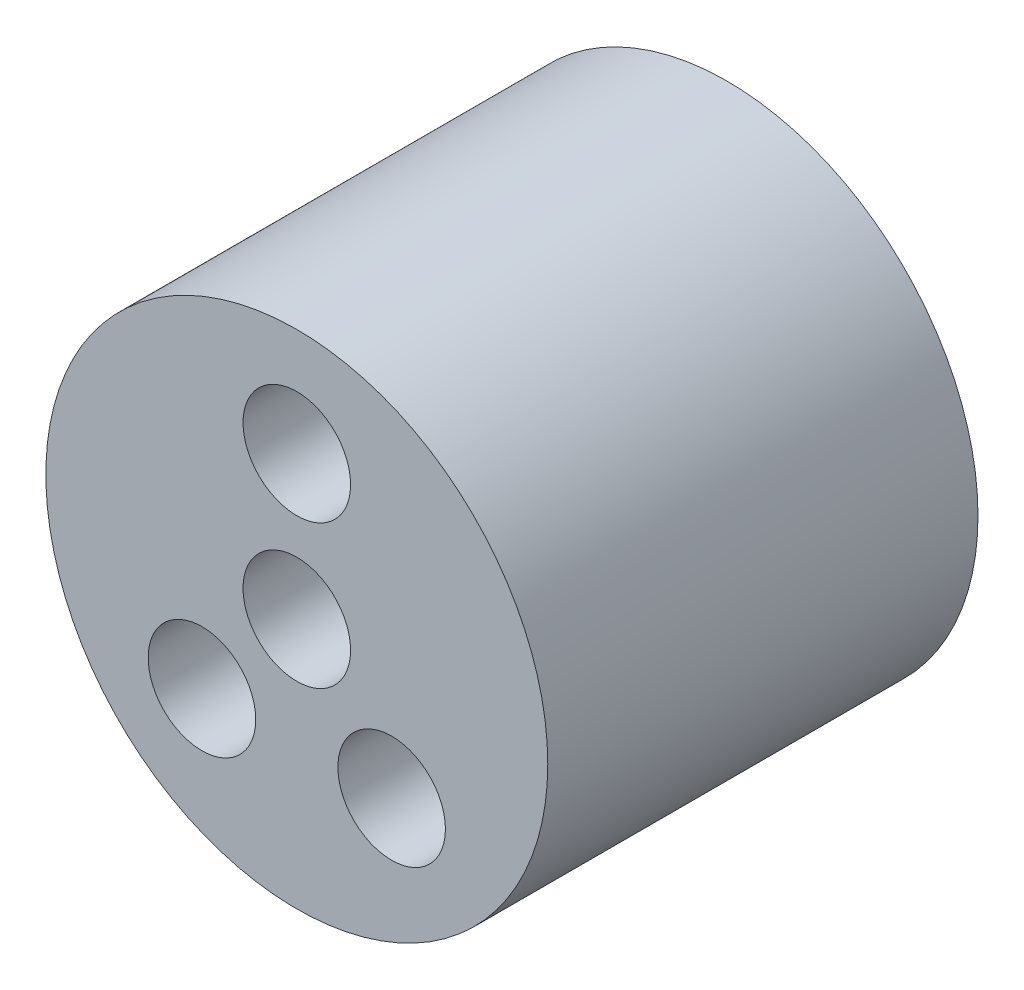
from build123d import *

# Parameters (mm, degrees)
SKETCH1_R           = 140
SKETCH1_R_2         = 30
BOSS_EXTRUDE1_DEPTH = 240


with BuildPart() as part:
    # Sketch1 → Boss-Extrude1 (new body)
    with BuildSketch(Plane.XY):
        Circle(SKETCH1_R)
        Circle(SKETCH1_R_2, mode=Mode.SUBTRACT)
        with Locations((0, 80)):
            Circle(SKETCH1_R_2, mode=Mode.SUBTRACT)
        with Locations((52.915026221, -60)):
            Circle(SKETCH1_R_2, mode=Mode.SUBTRACT)
        with Locations((-52.915026221, -60)):
            Circle(SKETCH1_R_2, mode=Mode.SUBTRACT)
    extrude(amount=BOSS_EXTRUDE1_DEPTH)


solid = part.part
